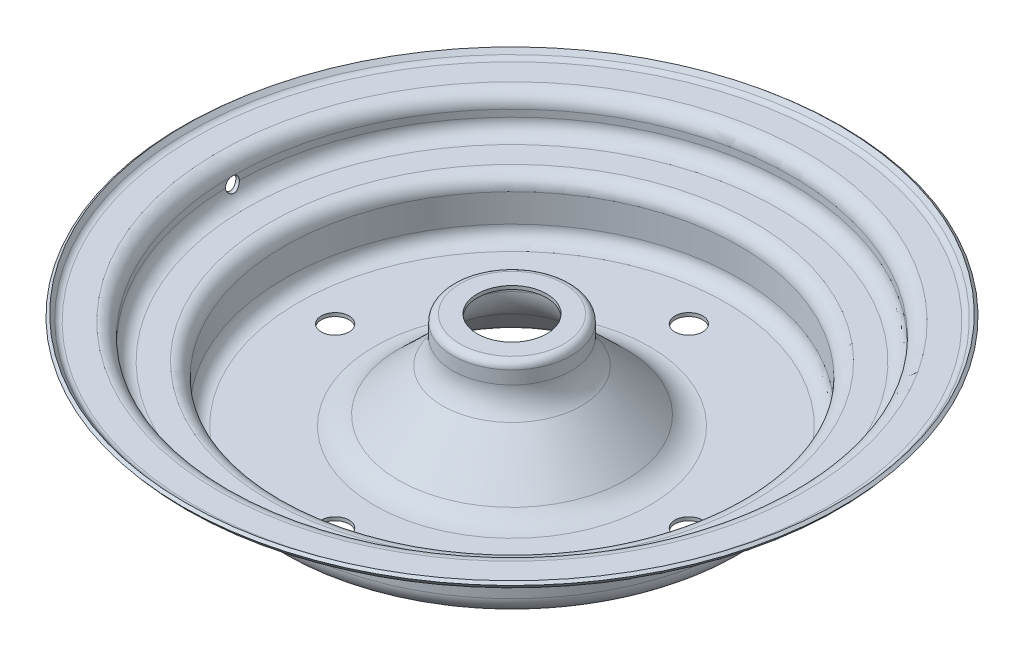
from build123d import *

# Parameters (mm, degrees)
IZIM2_R                    = 4
KES_EKSTR_ZYON1_DEPTH      = 10
KES_EKSTR_ZYON4_DEPTH      = 11
KES_EKSTR_ZYON4_DEPTH_BACK = 11
IZIM3_R                    = 2


with BuildPart() as part:
    # Çizim1 → Döndür1 (revolve)
    with BuildSketch(Plane.XY):
        with BuildLine():
            Line((-94.233955557, 34.680756072), (-93.226460103, 33.480069745))
            ThreePointArc((-93.226460103, 33.480069745), (-92.53960774, 32.95302939), (-91.694371216, 32.765644964))
            Line((-91.694371216, 32.765644964), (-84.626986533, 32.765644964))
            ThreePointArc((-84.626986533, 32.765644964), (-81.798559408, 31.594072089), (-80.626986533, 28.765644964))
            Line((-80.626986533, 28.765644964), (-80.626986533, 26.765644964))
            ThreePointArc((-80.626986533, 26.765644964), (-79.455413657, 23.93721784), (-76.626986533, 22.765644964))
            Line((-76.626986533, 22.765644964), (-69.626986533, 22.765644964))
            ThreePointArc((-69.626986533, 22.765644964), (-66.798559408, 21.594072089), (-65.626986533, 18.765644964))
            Line((-65.626986533, 18.765644964), (-65.626986533, 10.680756072))
            ThreePointArc((-65.626986533, 10.680756072), (-64.455413657, 7.852328947), (-61.626986533, 6.680756072))
            Line((-61.626986533, 6.680756072), (-39.669207854, 6.680756072))
            ThreePointArc((-39.669207854, 6.680756072), (-35.921580565, 7.409548508), (-32.72020176, 9.489698132))
            Line((-32.72020176, 9.489698132), (-20.050993906, 21.732458976))
            ThreePointArc((-20.050993906, 21.732458976), (-17.794293592, 25.017755847), (-17, 28.923516916))
            Line((-17, 28.923516916), (-17, 32.680756072))
            ThreePointArc((-17, 32.680756072), (-16.414213562, 34.094969634), (-15, 34.680756072))
            Line((-15, 34.680756072), (-10, 34.680756072))
            Line((-10, 34.680756072), (-10, 33.680756072))
            Line((-10, 33.680756072), (-11, 33.680756072))
            Line((-11, 33.680756072), (-15, 33.680756072))
            ThreePointArc((-15, 33.680756072), (-15.707106781, 33.387862853), (-16, 32.680756072))
            Line((-16, 32.680756072), (-16, 28.923516916))
            ThreePointArc((-16, 28.923516916), (-16.873722951, 24.62717974), (-19.356093297, 21.013353182))
            Line((-19.356093297, 21.013353182), (-32.02530115, 8.770592337))
            ThreePointArc((-32.02530115, 8.770592337), (-35.546817836, 6.482427751), (-39.669207854, 5.680756072))
            Line((-39.669207854, 5.680756072), (-61.626986533, 5.680756072))
            ThreePointArc((-61.626986533, 5.680756072), (-65.162520439, 7.145222166), (-66.626986533, 10.680756072))
            Line((-66.626986533, 10.680756072), (-66.626986533, 18.765644964))
            ThreePointArc((-66.626986533, 18.765644964), (-67.505666189, 20.886965308), (-69.626986533, 21.765644964))
            Line((-69.626986533, 21.765644964), (-76.626986533, 21.765644964))
            ThreePointArc((-76.626986533, 21.765644964), (-80.162520439, 23.230111058), (-81.626986533, 26.765644964))
            Line((-81.626986533, 26.765644964), (-81.626986533, 28.765644964))
            ThreePointArc((-81.626986533, 28.765644964), (-82.505666189, 30.886965308), (-84.626986533, 31.765644964))
            Line((-84.626986533, 31.765644964), (-91.694371216, 31.765644964))
            ThreePointArc((-91.694371216, 31.765644964), (-92.962226002, 32.046721603), (-93.992504546, 32.837282135))
            Line((-93.992504546, 32.837282135), (-95, 34.037968462))
            Line((-95, 34.037968462), (-94.233955557, 34.680756072))
        make_face()
    revolve(axis=Axis((0, 39.603638965, 0), (0, -1, 0)))

    # Çizim2 → Kes-Ekstrüzyon1 (cut)
    with BuildSketch(Plane(origin=(0, 6.680756072, 0), x_dir=(1, 0, 0), z_dir=(0, 1, 0))):
        with Locations((0, 50.9725)):
            Circle(IZIM2_R)
        with Locations((50.9725, 0)):
            Circle(IZIM2_R)
        with Locations((0, -50.9725)):
            Circle(IZIM2_R)
        with Locations((-50.9725, 0)):
            Circle(IZIM2_R)
    extrude(amount=-KES_EKSTR_ZYON1_DEPTH, mode=Mode.SUBTRACT)

    # Çizim3 → Kes-Ekstrüzyon4 (cut, two sides: drawn at the far end of the back side and taken through both)
    with BuildSketch(Plane(origin=(-80.626986533, 0, 0), x_dir=(0, 0, -1), z_dir=(1, 0, 0)).offset(-KES_EKSTR_ZYON4_DEPTH_BACK)):
        with Locations((0, 26.765644964)):
            Circle(IZIM3_R)
    extrude(amount=KES_EKSTR_ZYON4_DEPTH + KES_EKSTR_ZYON4_DEPTH_BACK, mode=Mode.SUBTRACT)


solid = part.part
